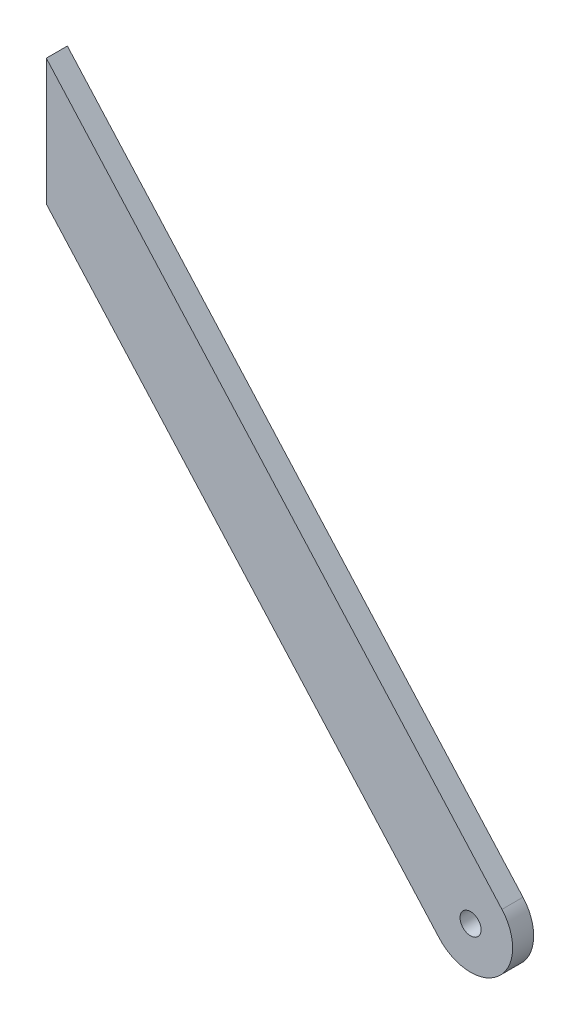
from build123d import *

# Parameters (mm, degrees)
SKETCH1_R           = 5
BOSS_EXTRUDE1_DEPTH = 10


with BuildPart() as part:
    # Sketch1 → Boss-Extrude1 (new body)
    with BuildSketch(Plane.XY):
        with BuildLine():
            Line((0, 0), (0, 60))
            Line((0, 60), (216.480906367, -182.033011233))
            ThreePointArc((216.480906367, -182.033011233), (214.90711985, -210.273464417), (186.666666667, -208.6996779))
            Line((186.666666667, -208.6996779), (0, 0))
        make_face()
        with Locations((201.573786517, -195.366344567)):
            Circle(SKETCH1_R, mode=Mode.SUBTRACT)
    extrude(amount=BOSS_EXTRUDE1_DEPTH)


solid = part.part
